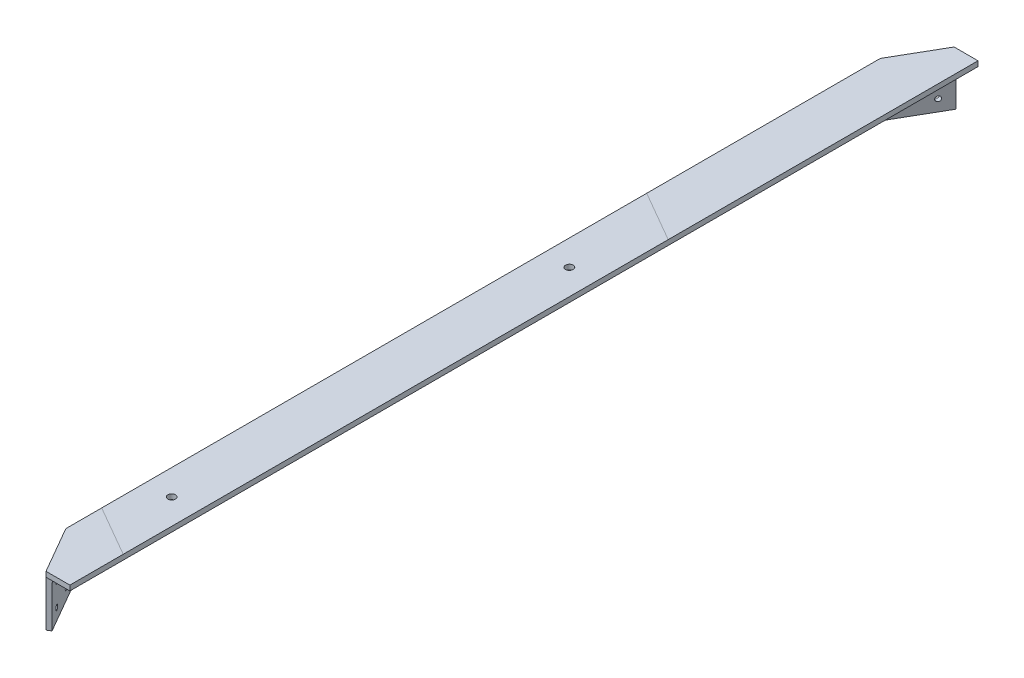
from build123d import *

# Parameters (mm, degrees)
BOSS_EXTRUDE1_DEPTH  = 640
BOSS_EXTRUDE2_DEPTH  = 8
BOSS_EXTRUDE3_DEPTH  = 72
SKETCH6_R            = 4
CUT_EXTRUDE1_DEPTH   = 8
FILLET1_R            = 10
FILLET2_R            = 8
FILLET1_OF_MIRROR1_R = 10
FILLET2_OF_MIRROR1_R = 8
SKETCH8_R            = 6
CUT_EXTRUDE2_DEPTH   = 8


with BuildPart() as part:
    # Sketch1 → Boss-Extrude1 (new body)
    with BuildSketch(Plane.XY):
        Polygon((-8, 8), (72, 8), (72, 0), (0, 0), (0, -72), (-8, -72), align=None)
    boss_extrude1 = extrude(amount=BOSS_EXTRUDE1_DEPTH)

    # Sketch3 → Boss-Extrude2 (add)
    with BuildSketch(Plane(origin=(0, 0, 0), x_dir=(1, 0, 0), z_dir=(0, 1, 0))):
        Polygon((-8, -640), (34.5, -713.612159322), (72, -713.612159322), (72, -640), align=None)
    boss_extrude2 = extrude(amount=BOSS_EXTRUDE2_DEPTH)

    # Sketch4 → Boss-Extrude3 (add)
    with BuildSketch(Plane.XZ):
        Polygon((-8, 640), (34.5, 713.612159322), (40.5, 710.148057707), (0, 640), align=None)
    boss_extrude3 = extrude(amount=BOSS_EXTRUDE3_DEPTH)

    # Sketch6 → Cut-Extrude1 (cut)
    with BuildSketch(Plane(origin=(-277.128129211, 0, 160), x_dir=(-0.4999999999999956, 0, -0.8660254037844413), z_dir=(0.8660254037844413, 0, -0.4999999999999956))):
        with Locations((-615.006258422, -18)):
            Circle(SKETCH6_R)
        with Locations((-574.506258422, -18)):
            Circle(SKETCH6_R)
        with Locations((-574.506258422, -54)):
            Circle(SKETCH6_R)
        with Locations((-615.006258422, -54)):
            Circle(SKETCH6_R)
    cut_extrude1 = extrude(amount=-CUT_EXTRUDE1_DEPTH, mode=Mode.SUBTRACT)

    # Fillet1
    fillet1_edges = [part.edges().sort_by_distance(p)[0] for p in [
        (0, -36, 640),
        (-8, -32, 640),
    ]]
    fillet(fillet1_edges, radius=FILLET1_R)

    # Fillet2
    fillet2_edges = [part.edges().sort_by_distance(p)[0] for p in [
        (20.919872981, 0, 676.234282891),
        (0, 0, 318.660254038),
        (0.340741737, 0, 639.908698527),
    ]]
    fillet(fillet2_edges, radius=FILLET2_R)

    # Mirror1: Boss-Extrude1, Boss-Extrude2, Boss-Extrude3, Cut-Extrude1 across plane
    add(boss_extrude1.mirror(Plane.XY))
    add(boss_extrude2.mirror(Plane.XY))
    add(boss_extrude3.mirror(Plane.XY))
    add(cut_extrude1.mirror(Plane.XY), mode=Mode.SUBTRACT)

    # Fillet1 of Mirror1
    fillet1_of_mirror1_edges = [part.edges().sort_by_distance(p)[0] for p in [
        (0, -36, -640),
        (-8, -32, -640),
    ]]
    fillet(fillet1_of_mirror1_edges, radius=FILLET1_OF_MIRROR1_R)

    # Fillet2 of Mirror1
    fillet2_of_mirror1_edges = [part.edges().sort_by_distance(p)[0] for p in [
        (20.919872981, 0, -676.234282891),
        (0, 0, -318.660254038),
        (0.340741737, 0, -639.908698527),
    ]]
    fillet(fillet2_of_mirror1_edges, radius=FILLET2_OF_MIRROR1_R)

    # Sketch8 → Cut-Extrude2 (cut)
    with BuildSketch(Plane(origin=(0, 8, 0), x_dir=(1, 0, 0), z_dir=(0, 1, 0))):
        with Locations(Location((32, 111.387840678, 0), (0, 0, 180))):
            Circle(SKETCH8_R)
        with Locations(Location((32, -513.612159322, 0), (0, 0, 180))):
            Circle(SKETCH8_R)
    extrude(amount=-CUT_EXTRUDE2_DEPTH, mode=Mode.SUBTRACT)


solid = part.part
